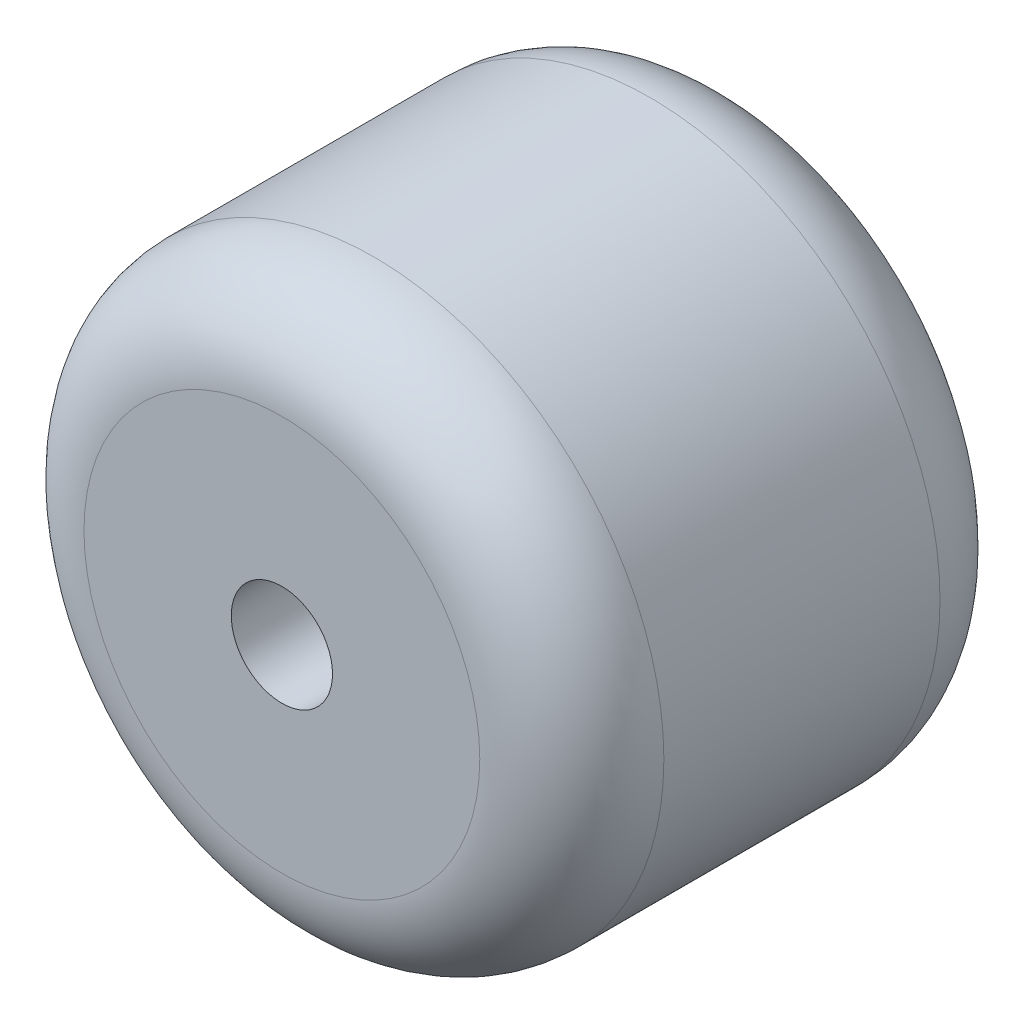
from build123d import *

# Parameters (mm, degrees)
SKETCH_1_R      = 15.75
SKETCH_1_R_2    = 2.75
EXTRUDE_1_DEPTH = 25
FILLET_1_R      = 5


with BuildPart() as part:
    # 草图1 → 凸台-拉伸1 (new body)
    with BuildSketch(Plane.XY):
        Circle(SKETCH_1_R)
        Circle(SKETCH_1_R_2, mode=Mode.SUBTRACT)
    extrude(amount=EXTRUDE_1_DEPTH)

    # 圆角1
    fillet_1_edges = [part.edges().sort_by_distance(p)[0] for p in [
        (-15.75, 0, 0),
        (-15.75, 0, 25),
    ]]
    fillet(fillet_1_edges, radius=FILLET_1_R)


solid = part.part
